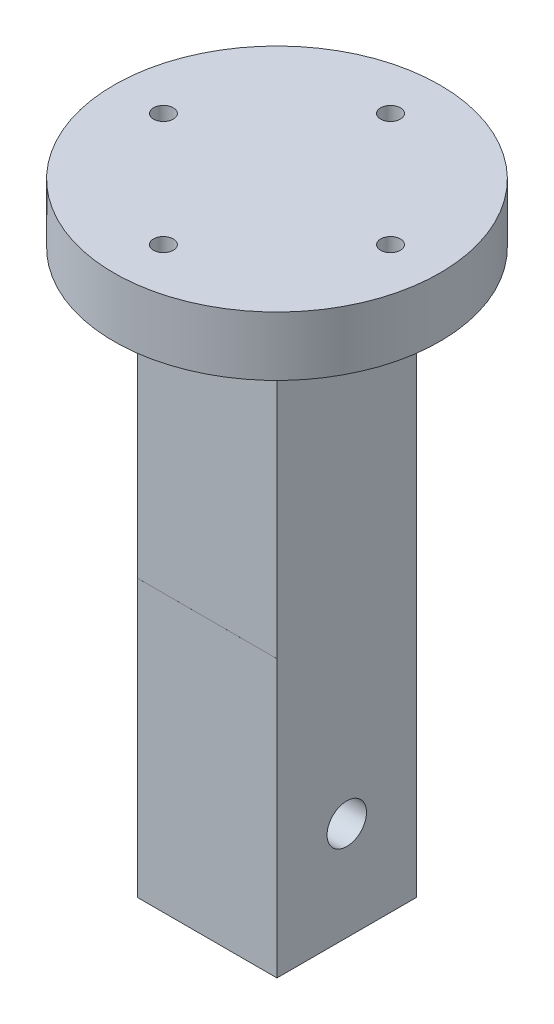
from build123d import *

# Parameters (mm, degrees)
SKETCH1_W           = 8.98144
SKETCH1_H           = 8.979072086
BOSS_EXTRUDE1_DEPTH = 18.415
SKETCH2_R           = 10.4775
BOSS_EXTRUDE2_DEPTH = 3.81
BOSS_EXTRUDE4_START = 5.08
SKETCH4_R           = 10.4775
BOSS_EXTRUDE4_DEPTH = 5.08
SKETCH5_R           = 20.080329598
CUT_EXTRUDE1_DEPTH  = 5.08
SKETCH6_R           = 11.7475
BOSS_EXTRUDE5_DEPTH = 1.27
SKETCH10_R          = 0.635
CUT_EXTRUDE3_DEPTH  = 5.08
SKETCH11_W          = 8.980256122
SKETCH11_H          = 8.980256122
BOSS_EXTRUDE6_DEPTH = 11.43
SKETCH12_R          = 1.27
CUT_EXTRUDE4_DEPTH  = 30.926826532
SKETCH13_R          = 16.332620974
SKETCH13_W          = 8.980256122
SKETCH13_H          = 8.980256122
CUT_EXTRUDE5_DEPTH  = 24.765


with BuildPart() as part:
    # Sketch1 → Boss-Extrude1 (new body)
    with BuildSketch(Plane(origin=(0, 0, 0), x_dir=(1, 0, 0), z_dir=(0, 1, 0))):
        Rectangle(SKETCH1_W, SKETCH1_H)
    extrude(amount=BOSS_EXTRUDE1_DEPTH)

    # Sketch2 → Boss-Extrude2 (add)
    with BuildSketch(Plane(origin=(0, 18.415, 0), x_dir=(1, 0, 0), z_dir=(0, 1, 0))):
        with Locations(Location((0, 0, 0), (0, 0, 90))):
            Circle(SKETCH2_R)
    extrude(amount=BOSS_EXTRUDE2_DEPTH)

    # Sketch4 → Boss-Extrude4 (add)
    with BuildSketch(Plane.XZ.offset(BOSS_EXTRUDE4_START)):
        with Locations(Location((0, 0, 0), (0, 0, 270))):
            Circle(SKETCH4_R)
    extrude(amount=-BOSS_EXTRUDE4_DEPTH)

    # Sketch5 → Cut-Extrude1 (cut)
    with BuildSketch(Plane.XZ.offset(5.08)):
        Circle(SKETCH5_R)
        Polygon((0, 17.195074229), (-1.836150497, 7.449555405), (-7.990949439, 15.225482088), (-5.087811539, 5.742952038), (-14.151268663, 9.767915487), (-7.173916273, 2.72070757), (-17.069702778, 2.072637164), (-7.616563244, -0.924818214), (-16.077673698, -6.097457355), (-6.314347365, -4.358479291), (-11.402443331, -12.870697876), (-3.565590601, -6.793665288), (-4.115050612, -16.695416623), (0, -7.67250444), (4.115050612, -16.695416623), (3.565590601, -6.793665288), (11.402443331, -12.870697876), (6.314347365, -4.358479291), (16.077673698, -6.097457355), (7.616563244, -0.924818214), (17.069702778, 2.072637164), (7.173916273, 2.72070757), (14.151268663, 9.767915487), (5.087811539, 5.742952038), (7.990949439, 15.225482088), (1.836150497, 7.449555405), align=None, mode=Mode.SUBTRACT)
    extrude(amount=-CUT_EXTRUDE1_DEPTH, mode=Mode.SUBTRACT)

    # Sketch6 → Boss-Extrude5 (add)
    with BuildSketch(Plane.XZ.offset(5.08)):
        with Locations(Location((0, 0, 0), (0, 0, 270))):
            Circle(SKETCH6_R)
    extrude(amount=BOSS_EXTRUDE5_DEPTH)

    # Sketch10 → Cut-Extrude3 (cut)
    with BuildSketch(Plane(origin=(0, 22.225, 0), x_dir=(1, 0, 0), z_dir=(0, 1, 0))):
        with Locations(Location((0, 7.3025, 0), (0, 0, 270))):
            Circle(SKETCH10_R)
        with Locations(Location((7.3025, 0, 0), (0, 0, 270))):
            Circle(SKETCH10_R)
        with Locations(Location((-7.3025, 0, 0), (0, 0, 270))):
            Circle(SKETCH10_R)
        with Locations(Location((0, -7.3025, 0), (0, 0, 270))):
            Circle(SKETCH10_R)
    extrude(amount=-CUT_EXTRUDE3_DEPTH, mode=Mode.SUBTRACT)

    # Sketch11 → Boss-Extrude6 (add)
    with BuildSketch(Plane.XZ.offset(6.35)):
        Rectangle(SKETCH11_W, SKETCH11_H)
    extrude(amount=BOSS_EXTRUDE6_DEPTH)

    # Sketch12 → Cut-Extrude4 (cut, through all)
    with BuildSketch(Plane(origin=(4.490128061, 0, 0), x_dir=(0, 0, -1), z_dir=(1, 0, 0))):
        with Locations((0, -11.43)):
            Circle(SKETCH12_R)
    extrude(amount=-CUT_EXTRUDE4_DEPTH, mode=Mode.SUBTRACT)

    # Sketch13 → Cut-Extrude5 (cut)
    with BuildSketch(Plane.XZ.offset(6.35)):
        Circle(SKETCH13_R)
        Rectangle(SKETCH13_W, SKETCH13_H, mode=Mode.SUBTRACT)
    extrude(amount=-CUT_EXTRUDE5_DEPTH, mode=Mode.SUBTRACT)


solid = part.part
